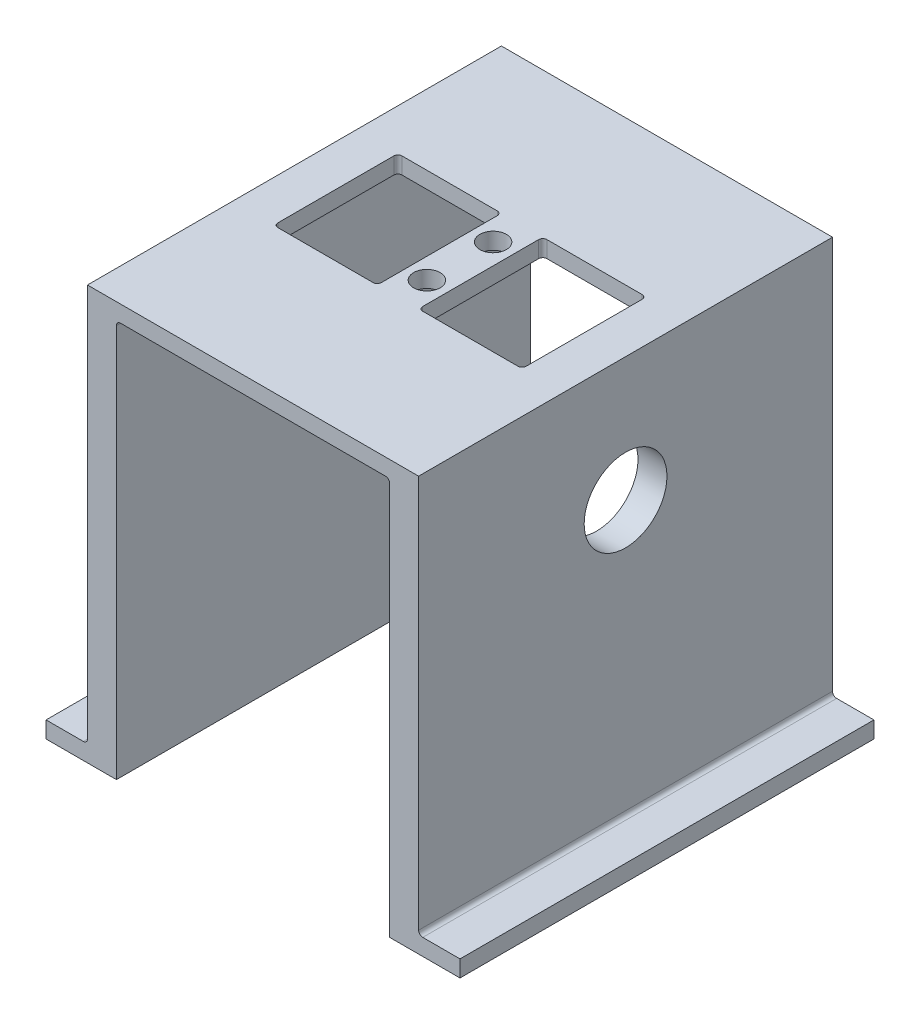
from build123d import *

# Parameters (mm, degrees)
EXTRUDE_1_DEPTH     = 25
CUT_EXTRUDE_1_DEPTH = 25
SKETCH_3_R          = 1.6
CUT_EXTRUDE_2_DEPTH = 2
SKETCH_4_R          = 5
CUT_EXTRUDE_3_DEPTH = 25


with BuildPart() as part:
    # 草图1 → 凸台-拉伸1 (new, symmetric)
    with BuildSketch(Plane.XY):
        Polygon((0, 0), (-25, 0), (-25, 50), (25, 50), (25, 0), align=None)
    extrude(amount=EXTRUDE_1_DEPTH, both=True)

    # 草图2 → 切除-拉伸1 (cut, symmetric)
    with BuildSketch(Plane.XY):
        with BuildLine():
            Line((-25, 50), (-20, 50))
            Line((-20, 50), (-20, 2.5))
            ThreePointArc((-20, 2.5), (-20.146446609, 2.146446609), (-20.5, 2))
            Line((-20.5, 2), (-25, 2))
            Line((-25, 2), (-25, 50))
        make_face()
        with BuildLine():
            Line((25, 50), (20, 50))
            Line((20, 50), (20, 2.5))
            ThreePointArc((20, 2.5), (20.146446609, 2.146446609), (20.5, 2))
            Line((20.5, 2), (25, 2))
            Line((25, 2), (25, 50))
        make_face()
        with BuildLine():
            Line((-16.5, 0), (16.5, 0))
            Line((16.5, 0), (16.5, 47.5))
            ThreePointArc((16.5, 47.5), (16.353553391, 47.853553391), (16, 48))
            Line((16, 48), (-16, 48))
            ThreePointArc((-16, 48), (-16.353553391, 47.853553391), (-16.5, 47.5))
            Line((-16.5, 47.5), (-16.5, 0))
        make_face()
    extrude(amount=CUT_EXTRUDE_1_DEPTH, both=True, mode=Mode.SUBTRACT)

    # 草图3 → 切除-拉伸2 (cut)
    with BuildSketch(Plane(origin=(0, 50, 0), x_dir=(1, 0, 0), z_dir=(0, 1, 0))):
        with Locations(Location((0, 4, 0), (0, 0, 270))):
            Circle(SKETCH_3_R)
        with Locations(Location((0, -4, 0), (0, 0, 270))):
            Circle(SKETCH_3_R)
        with BuildLine():
            Line((3, 7.5), (14.5, 7.5))
            ThreePointArc((14.5, 7.5), (14.853553391, 7.353553391), (15, 7))
            Line((15, 7), (15, -7))
            ThreePointArc((15, -7), (14.853553391, -7.353553391), (14.5, -7.5))
            Line((14.5, -7.5), (3, -7.5))
            ThreePointArc((3, -7.5), (2.646446609, -7.353553391), (2.5, -7))
            Line((2.5, -7), (2.5, 7))
            ThreePointArc((2.5, 7), (2.646446609, 7.353553391), (3, 7.5))
        make_face()
        with BuildLine():
            Line((-14.5, 7.5), (-3, 7.5))
            ThreePointArc((-3, 7.5), (-2.646446609, 7.353553391), (-2.5, 7))
            Line((-2.5, 7), (-2.5, 0))
            Line((-2.5, 0), (-2.5, -7))
            ThreePointArc((-2.5, -7), (-2.646446609, -7.353553391), (-3, -7.5))
            Line((-3, -7.5), (-14.5, -7.5))
            ThreePointArc((-14.5, -7.5), (-14.853553391, -7.353553391), (-15, -7))
            Line((-15, -7), (-15, 7))
            ThreePointArc((-15, 7), (-14.853553391, 7.353553391), (-14.5, 7.5))
        make_face()
    extrude(amount=-CUT_EXTRUDE_2_DEPTH, mode=Mode.SUBTRACT)

    # 草图4 → 切除-拉伸3 (cut, symmetric)
    with BuildSketch(Plane(origin=(0, 0, 0), x_dir=(0, 0, -1), z_dir=(1, 0, 0))):
        with Locations((0, 35)):
            Circle(SKETCH_4_R)
    extrude(amount=CUT_EXTRUDE_3_DEPTH, both=True, mode=Mode.SUBTRACT)


solid = part.part
